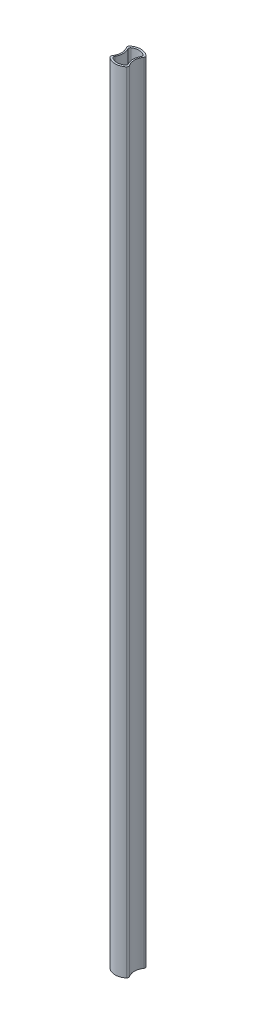
from build123d import *

# Parameters (mm, degrees)
BOSS_EXTRUDE1_DEPTH = 400


with BuildPart() as part:
    # Sketch1 → Boss-Extrude1 (new body)
    with BuildSketch(Plane(origin=(0, 0, 0), x_dir=(1, 0, 0), z_dir=(0, 1, 0))):
        with BuildLine():
            ThreePointArc((-4.185606061, -4.972997276), (0, -6.5), (4.185606061, -4.972997276))
            ThreePointArc((4.185606061, -4.972997276), (4.532194193, -4.345235079), (4.369444444, -3.646864669))
            ThreePointArc((4.369444444, -3.646864669), (3.25, 0), (4.369444444, 3.646864669))
            ThreePointArc((4.369444444, 3.646864669), (4.532194193, 4.345235079), (4.185606061, 4.972997276))
            ThreePointArc((4.185606061, 4.972997276), (0, 6.5), (-4.185606061, 4.972997276))
            ThreePointArc((-4.185606061, 4.972997276), (-4.532194193, 4.345235079), (-4.369444444, 3.646864669))
            ThreePointArc((-4.369444444, 3.646864669), (-3.25, 0), (-4.369444444, -3.646864669))
            ThreePointArc((-4.369444444, -3.646864669), (-4.532194193, -4.345235079), (-4.185606061, -4.972997276))
        make_face()
        with BuildLine():
            ThreePointArc((-3.055555556, -4.573136806), (0, -5.5), (3.055555556, -4.573136806))
            ThreePointArc((3.055555556, -4.573136806), (3.473728991, -3.969367404), (3.366666667, -3.242769735))
            ThreePointArc((3.366666667, -3.242769735), (2.5, 0), (3.366666667, 3.242769735))
            ThreePointArc((3.366666667, 3.242769735), (3.473728991, 3.969367404), (3.055555556, 4.573136806))
            ThreePointArc((3.055555556, 4.573136806), (0, 5.5), (-3.055555556, 4.573136806))
            ThreePointArc((-3.055555556, 4.573136806), (-3.473728991, 3.969367404), (-3.366666667, 3.242769735))
            ThreePointArc((-3.366666667, 3.242769735), (-2.5, 0), (-3.366666667, -3.242769735))
            ThreePointArc((-3.366666667, -3.242769735), (-3.473728991, -3.969367404), (-3.055555556, -4.573136806))
        make_face(mode=Mode.SUBTRACT)
    extrude(amount=BOSS_EXTRUDE1_DEPTH)


solid = part.part
